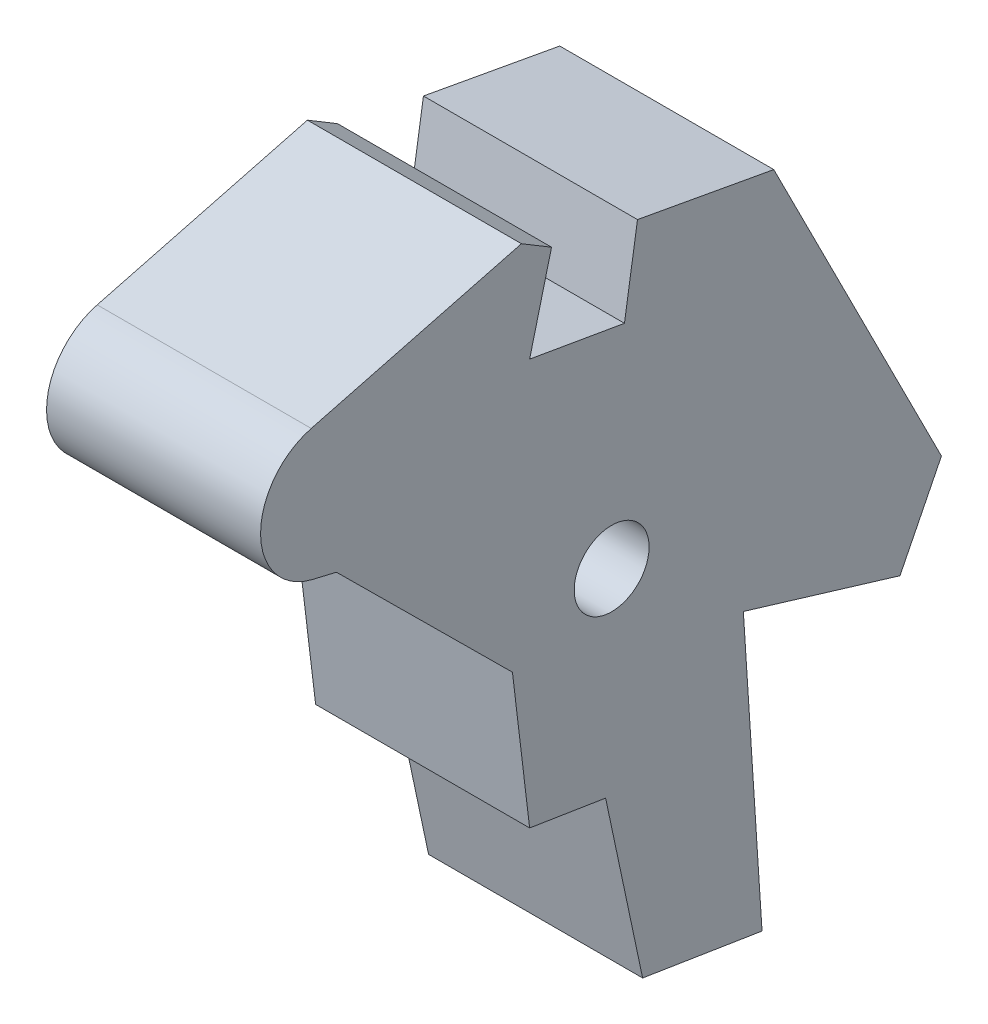
from build123d import *

# Parameters (mm, degrees)
SKETCH_1_R      = 2.1
EXTRUDE_1_DEPTH = 6


with BuildPart() as part:
    # 스케치1 → 보스-돌출1 (new, symmetric)
    with BuildSketch(Plane(origin=(0, 0, 0), x_dir=(0, 0, -1), z_dir=(1, 0, 0))):
        with BuildLine():
            Line((-16.843616133, 15.225059748), (-5.058260457, 18.301873078))
            Line((-5.058260457, 18.301873078), (-3.370048504, 17.287466348))
            Line((-3.370048504, 17.287466348), (-4.598836935, 12.46676509))
            Line((-4.598836935, 12.46676509), (0.718846359, 11.548294979))
            Line((0.718846359, 11.548294979), (1.44805016, 16.220144947))
            Line((1.44805016, 16.220144947), (9.090162136, 14.827237538))
            Line((9.090162136, 14.827237538), (18.490753638, -3.782754553))
            Line((18.490753638, -3.782754553), (16.165658803, -8.432944223))
            Line((16.165658803, -8.432944223), (7.383267841, -5.77780277))
            Line((7.383267841, -5.77780277), (8.431827356, -21.818977094))
            Line((8.431827356, -21.818977094), (1.737192047, -20.750684226))
            Line((1.737192047, -20.750684226), (-0.33854919, -10.977402568))
            Line((-0.33854919, -10.977402568), (-4.598836935, -10.297569417))
            Line((-4.598836935, -10.297569417), (-5.563105297, -2.251013026))
            Line((-5.563105297, -2.251013026), (-15.432595358, 7.537806593))
            Line((-15.432595358, 7.537806593), (-16.755575012, 7.849664338))
            ThreePointArc((-16.755575012, 7.849664338), (-19.683449159, 11.502937082), (-16.843616133, 15.225059748))
        make_face()
        Circle(SKETCH_1_R, mode=Mode.SUBTRACT)
    extrude(amount=EXTRUDE_1_DEPTH, both=True)


solid = part.part
